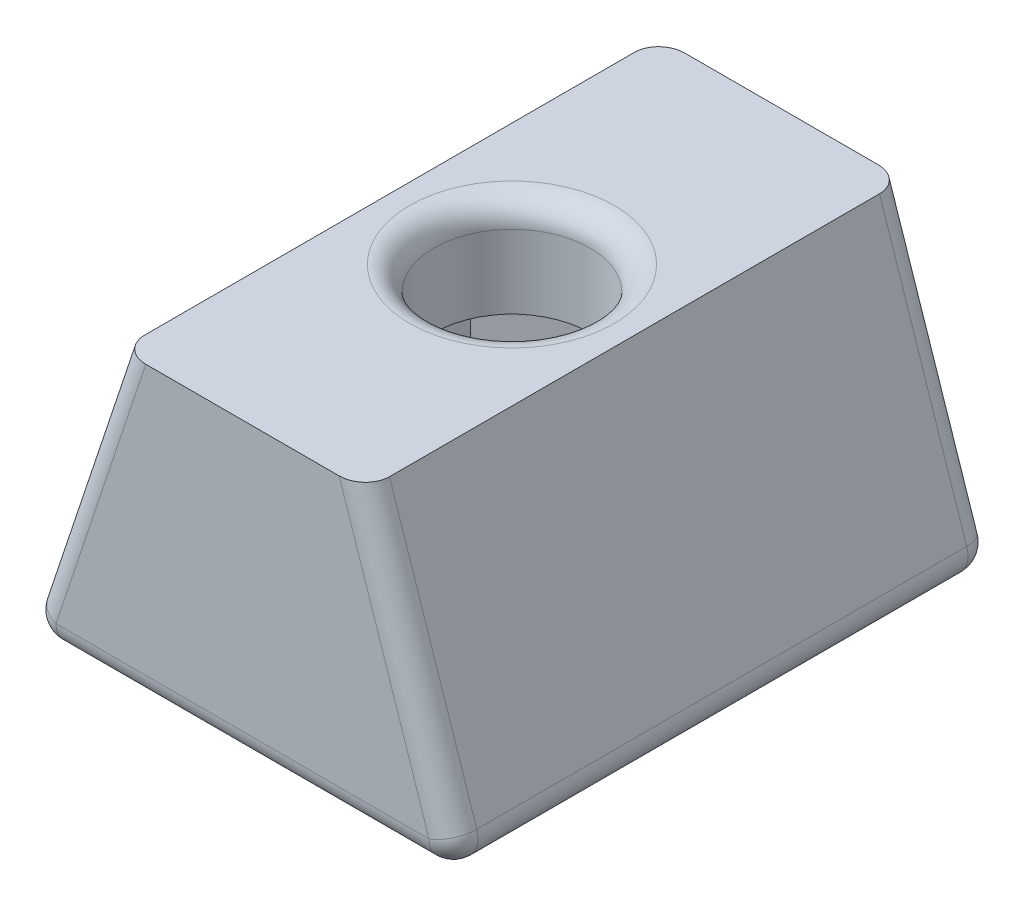
from build123d import *

# Parameters (mm, degrees)
BOSS_EXTRUDE1_DEPTH         = 22
CUT_EXTRUDE1_DEPTH          = 8
F_1_4_0_25_DIAMETER_HOLE1_D = 6.35
FILLET2_R                   = 1


with BuildPart() as part:
    # Sketch2 → Boss-Extrude1 (new body)
    with BuildSketch(Plane.XY):
        Polygon((0, 0), (18, 0), (14.00115161, 12), (3.99884839, 12), align=None)
    extrude(amount=-BOSS_EXTRUDE1_DEPTH)

    # Sketch3 → Cut-Extrude1 (cut)
    with BuildSketch(Plane.XZ):
        Polygon((13, -13.309401077), (13, -8.690598923), (9, -6.381197846), (5, -8.690598923), (5, -13.309401077), (9, -15.618802154), align=None)
    extrude(amount=-CUT_EXTRUDE1_DEPTH, mode=Mode.SUBTRACT)

    # 1/4 (0.25) Diameter Hole1 (through all)
    with Locations(Plane(origin=(0, 12, 0), x_dir=(1, 0, 0), z_dir=(0, 1, 0))):
        with Locations((8.99884839, 11)):
            Hole(F_1_4_0_25_DIAMETER_HOLE1_D / 2)

    # Fillet2
    fillet2_edges = [part.edges().sort_by_distance(p)[0] for p in [
        (16.000575805, 6, -22),
        (11, 0, -14.464101615),
        (13, 0, -11),
        (11, 0, -7.535898385),
        (7, 0, -7.535898385),
        (5, 0, -11),
        (7, 0, -14.464101615),
        (12.17384839, 12, -11),
        (1.999424195, 6, -22),
        (16.000575805, 6, 0),
        (9, 0, 0),
        (1.999424195, 6, 0),
        (18, 0, -11),
        (0, 0, -11),
        (9, 0, -22),
    ]]
    fillet(fillet2_edges, radius=FILLET2_R)


solid = part.part
